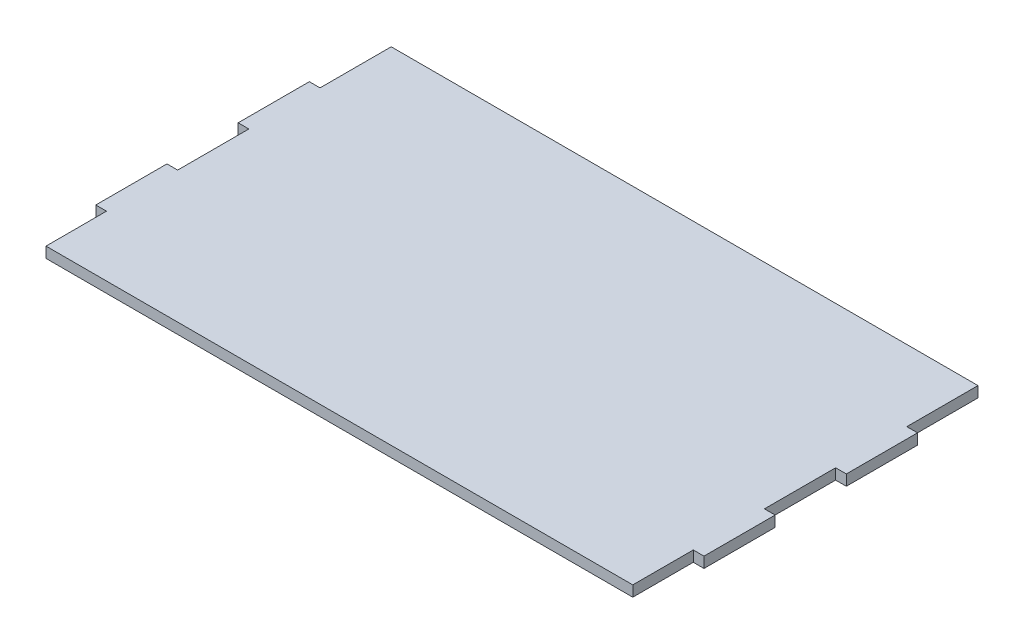
from build123d import *

# Parameters (mm, degrees)
BOSS_EXTRUDE1_DEPTH = 2.7


with BuildPart() as part:
    # Sketch2 → Boss-Extrude1 (new body)
    with BuildSketch(Plane(origin=(0, 0, 0), x_dir=(1, 0, 0), z_dir=(0, 1, 0))):
        Polygon((-76.7, -26.931), (-76.7, -8.977), (-74, -8.977), (-74, 8.977), (-76.7, 8.977), (-76.7, 26.931), (-74, 26.931), (-74, 44.885), (74, 44.885), (74, 26.931), (76.7, 26.931), (76.7, 8.977), (74, 8.977), (74, -8.977), (76.7, -8.977), (76.7, -26.931), (74, -26.931), (74, -42.185), (-74, -42.185), (-74, -26.931), align=None)
    extrude(amount=BOSS_EXTRUDE1_DEPTH)


solid = part.part
